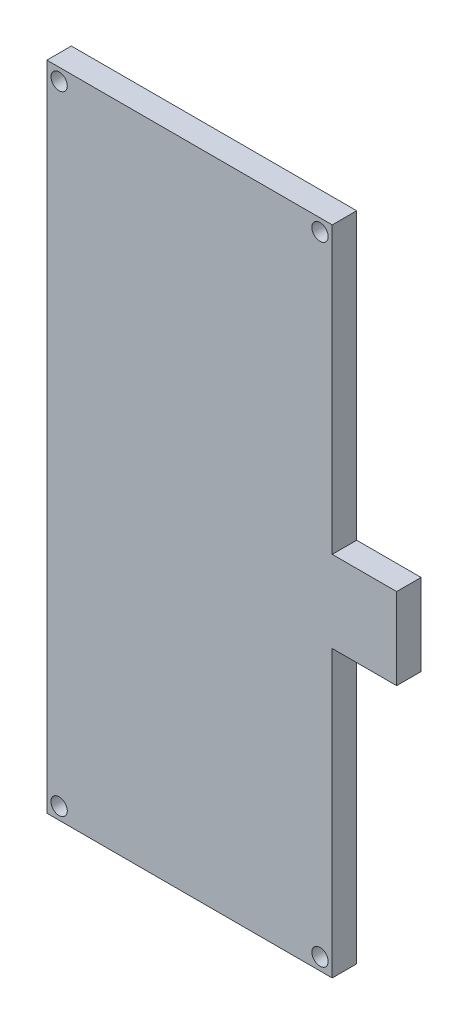
from build123d import *

# Parameters (mm, degrees)
SKETCH1_W           = 35
SKETCH1_H           = 80
BOSS_EXTRUDE1_DEPTH = 3
SKETCH2_W           = 9.965503069
SKETCH2_H           = 10
BOSS_EXTRUDE2_DEPTH = 3
SKETCH3_R           = 1
CUT_EXTRUDE2_DEPTH  = 20.272


with BuildPart() as part:
    # Sketch1 → Boss-Extrude1 (new body)
    with BuildSketch(Plane.XY):
        Rectangle(SKETCH1_W, SKETCH1_H)
    extrude(amount=BOSS_EXTRUDE1_DEPTH)

    # Sketch2 → Boss-Extrude2 (add)
    with BuildSketch(Plane.XY):
        with Locations((20.417248466, 0)):
            Rectangle(SKETCH2_W, SKETCH2_H)
    extrude(amount=BOSS_EXTRUDE2_DEPTH)

    # Sketch3 → Cut-Extrude2 (cut)
    with BuildSketch(Plane.XY):
        with Locations(Location((16, 38.5, 0), (0, 0, 180))):
            Circle(SKETCH3_R)
        with Locations(Location((-16, 38.5, 0), (0, 0, 180))):
            Circle(SKETCH3_R)
        with Locations(Location((16, -38.5, 0), (0, 0, 180))):
            Circle(SKETCH3_R)
        with Locations(Location((-16, -38.5, 0), (0, 0, 180))):
            Circle(SKETCH3_R)
    extrude(amount=CUT_EXTRUDE2_DEPTH, mode=Mode.SUBTRACT)


solid = part.part
